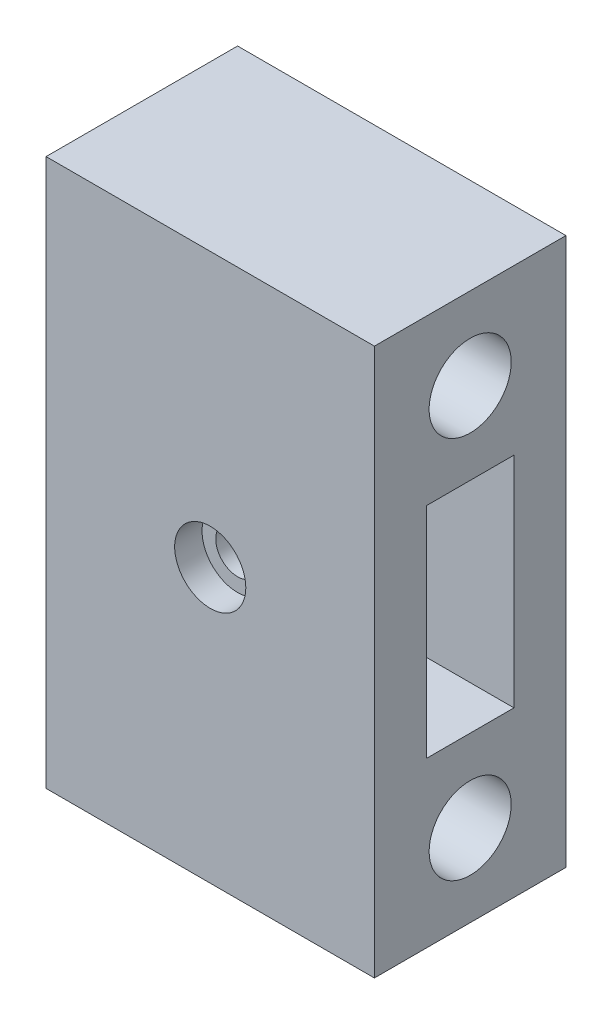
from build123d import *

# Parameters (mm, degrees)
SKETCH1_W               = 60
SKETCH1_H               = 100
BOSS_EXTRUDE1_DEPTH     = 35
SKETCH3_R               = 7.5
SKETCH3_W               = 16
SKETCH3_H               = 40
CUT_EXTRUDE1_DEPTH      = 55
CUT_EXTRUDE2_DEPTH      = 69.007352544
CUT_EXTRUDE2_DEPTH_BACK = 69.007352544
SKETCH5_R               = 4
SKETCH7_R               = 6.5
CUT_EXTRUDE3_DEPTH      = 5
CUT_EXTRUDE5_DEPTH      = 7.5


with BuildPart() as part:
    # Sketch1 → Boss-Extrude1 (new body)
    with BuildSketch(Plane.XY):
        Rectangle(SKETCH1_W, SKETCH1_H)
    extrude(amount=BOSS_EXTRUDE1_DEPTH)

    # Sketch3 → Cut-Extrude1 (cut)
    with BuildSketch(Plane(origin=(30, 0, 0), x_dir=(0, 0, -1), z_dir=(1, 0, 0))):
        with Locations((-17.5, 35)):
            Circle(SKETCH3_R)
        with Locations(Location((-17.5, -35, 0), (0, 0, 180))):
            Circle(SKETCH3_R)
        with Locations((-17.5, 0)):
            Rectangle(SKETCH3_W, SKETCH3_H)
    extrude(amount=-CUT_EXTRUDE1_DEPTH, mode=Mode.SUBTRACT)

    # Sketch5 → Cut-Extrude2 (cut, two sides: drawn at the far end of the back side and taken through both)
    with BuildSketch(Plane(origin=(0, 0, 0), x_dir=(-1, 0, 0), z_dir=(0, 0, -1)).offset(-CUT_EXTRUDE2_DEPTH_BACK)):
        Circle(SKETCH5_R)
    extrude(amount=CUT_EXTRUDE2_DEPTH + CUT_EXTRUDE2_DEPTH_BACK, mode=Mode.SUBTRACT)

    # Sketch7 → Cut-Extrude3 (cut)
    with BuildSketch(Plane.XY.offset(35)):
        Circle(SKETCH7_R)
    extrude(amount=-CUT_EXTRUDE3_DEPTH, mode=Mode.SUBTRACT)

    # Sketch8 → Cut-Extrude5 (cut)
    with BuildSketch(Plane(origin=(0, 0, 0), x_dir=(-1, 0, 0), z_dir=(0, 0, -1))):
        Polygon((0, 8.666604891), (-7.5055, 4.333302445), (-7.5055, -4.333302445), (0, -8.666604891), (7.5055, -4.333302445), (7.5055, 4.333302445), align=None)
    extrude(amount=-CUT_EXTRUDE5_DEPTH, mode=Mode.SUBTRACT)


solid = part.part
